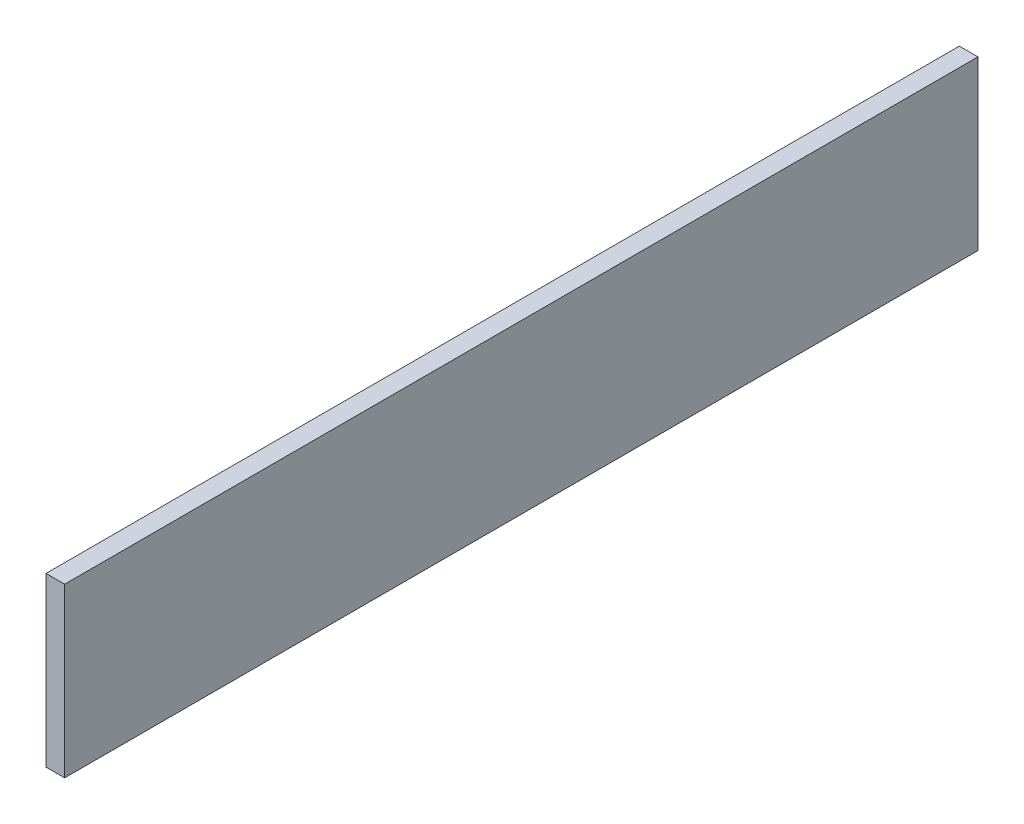
from build123d import *

# Parameters (mm, degrees)
SKETCH1_W           = 622.3
SKETCH1_H           = 114.3
BOSS_EXTRUDE1_DEPTH = 12.7


with BuildPart() as part:
    # Sketch1 → Boss-Extrude1 (new body)
    with BuildSketch(Plane(origin=(0, 0, 0), x_dir=(0, 0, -1), z_dir=(1, 0, 0))):
        with Locations((311.15, 57.15)):
            Rectangle(SKETCH1_W, SKETCH1_H)
    extrude(amount=BOSS_EXTRUDE1_DEPTH)


solid = part.part
